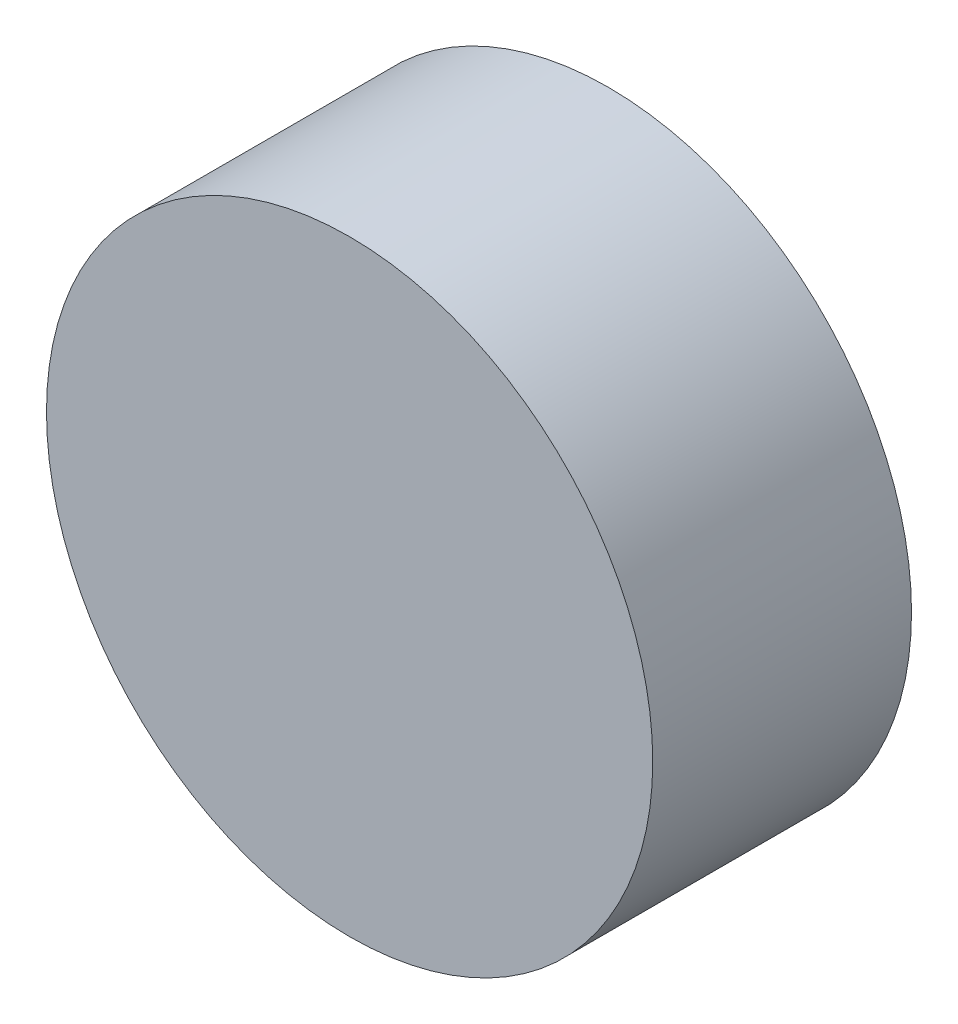
from build123d import *

# Parameters (mm, degrees)
SKETCH1_R           = 32.8
BOSS_EXTRUDE1_DEPTH = 28


with BuildPart() as part:
    # Sketch1 → Boss-Extrude1 (new body)
    with BuildSketch(Plane.XY):
        Circle(SKETCH1_R)
    extrude(amount=BOSS_EXTRUDE1_DEPTH)


solid = part.part
